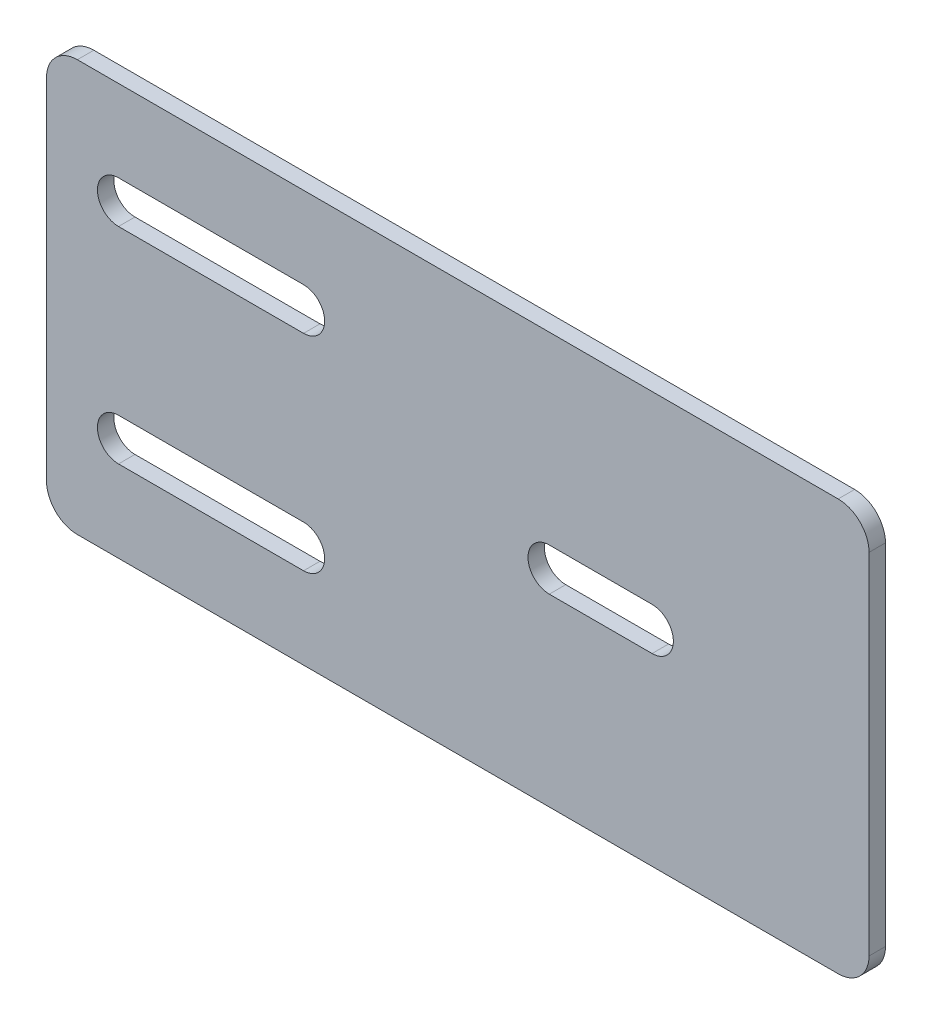
from build123d import *

# Parameters (mm, degrees)
SKETCH1_W           = 80
SKETCH1_H           = 40
BOSS_EXTRUDE1_DEPTH = 1.6
FILLET1_R           = 3


with BuildPart() as part:
    # Sketch1 → Boss-Extrude1 (new body)
    with BuildSketch(Plane.XY):
        Rectangle(SKETCH1_W, SKETCH1_H)
        with BuildLine():
            Line((-15, 7.95), (-33, 7.95))
            ThreePointArc((-33, 7.95), (-35.05, 10), (-33, 12.05))
            Line((-33, 12.05), (-15, 12.05))
            ThreePointArc((-15, 12.05), (-12.95, 10), (-15, 7.95))
        make_face(mode=Mode.SUBTRACT)
        with BuildLine():
            Line((-15, -7.95), (-33, -7.95))
            ThreePointArc((-33, -7.95), (-35.05, -10), (-33, -12.05))
            Line((-33, -12.05), (-15, -12.05))
            ThreePointArc((-15, -12.05), (-12.95, -10), (-15, -7.95))
        make_face(mode=Mode.SUBTRACT)
        with BuildLine():
            Line((8.9, 2.07), (18.9, 2.07))
            ThreePointArc((18.9, 2.07), (20.97, 0), (18.9, -2.07))
            Line((18.9, -2.07), (8.9, -2.07))
            ThreePointArc((8.9, -2.07), (6.83, 0), (8.9, 2.07))
        make_face(mode=Mode.SUBTRACT)
    extrude(amount=BOSS_EXTRUDE1_DEPTH)

    # Fillet1
    fillet1_edges = [part.edges().sort_by_distance(p)[0] for p in [
        (40, -20, 0.8),
        (-40, -20, 0.8),
        (-40, 20, 0.8),
        (40, 20, 0.8),
    ]]
    fillet(fillet1_edges, radius=FILLET1_R)


solid = part.part
